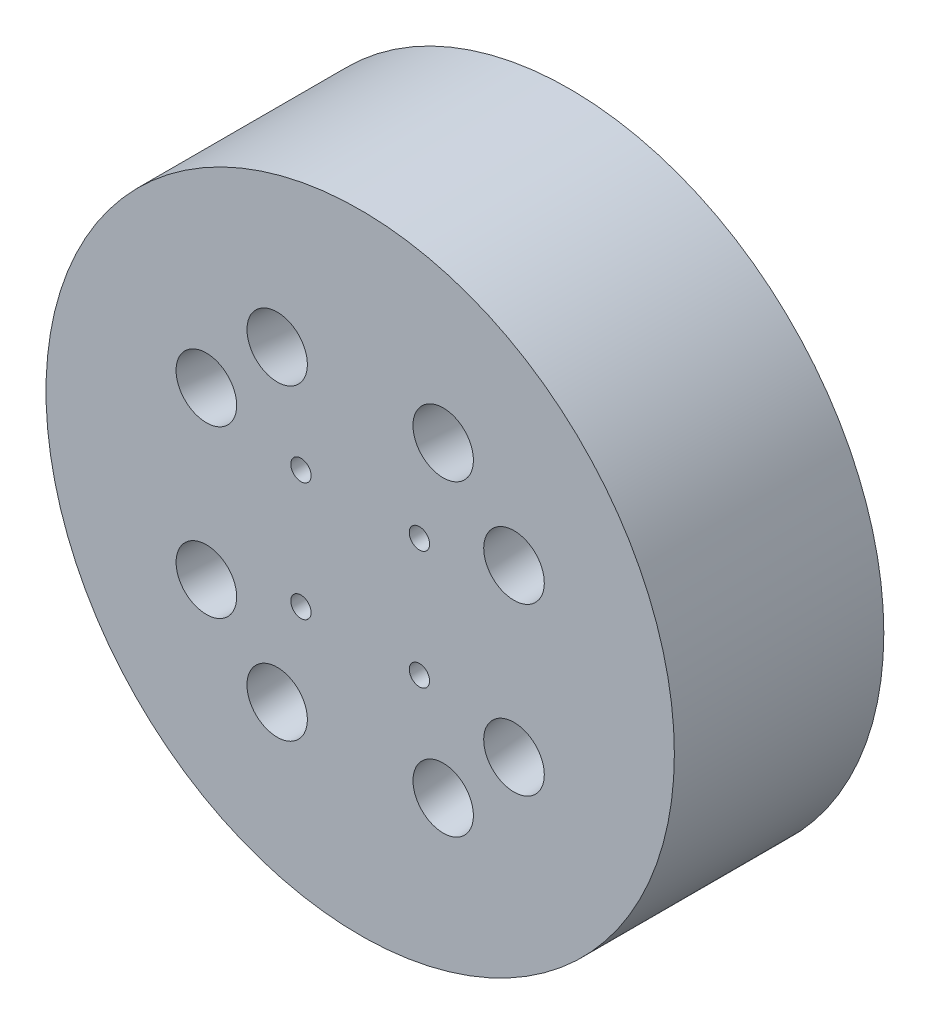
from build123d import *

# Parameters (mm, degrees)
SKETCH1_R                   = 15
BOSS_EXTRUDE1_DEPTH         = 10
SKETCH2_R                   = 0.484915
CUT_EXTRUDE1_DEPTH          = 10
CIRPATTERN1_COUNT           = 4
SKETCH7_R                   = 1.44135
CUT_EXTRUDE2_DEPTH          = 24.34691072
CIRPATTERN2_COUNT           = 4
CIRPATTERN2_COPY_1_SKETCH_R = 1.44135
CIRPATTERN2_COPY_1_DEPTH    = 24.34691072
CIRPATTERN2_COPY_2_SKETCH_R = 1.44135
CIRPATTERN2_COPY_2_DEPTH    = 24.34691072
CIRPATTERN2_COPY_3_SKETCH_R = 1.44135
CIRPATTERN2_COPY_3_DEPTH    = 24.34691072


with BuildPart() as part:
    # Sketch1 → Boss-Extrude1 (new body)
    with BuildSketch(Plane.XY):
        Circle(SKETCH1_R)
    extrude(amount=BOSS_EXTRUDE1_DEPTH)

    # Sketch2 → Cut-Extrude1 (cut)
    with BuildSketch(Plane.XY.offset(10)):
        with Locations((2.828427125, 2.828427125)):
            Circle(SKETCH2_R)
    cut_extrude1 = extrude(amount=-CUT_EXTRUDE1_DEPTH, mode=Mode.SUBTRACT)

    # CirPattern1: Cut-Extrude1 ×4 about axis
    cirpattern1_axis = Axis((0, 0, 10), (0, 0, -1))
    for i in range(1, CIRPATTERN1_COUNT):
        add(cut_extrude1.rotate(cirpattern1_axis, i * 360 / CIRPATTERN1_COUNT), mode=Mode.SUBTRACT)

    # Sketch7 → Cut-Extrude2 (cut, symmetric)
    with BuildSketch(Plane(origin=(-0.025287604, 0.006355569, 0.298027772), x_dir=(0.2437507452891652, 0.9698379112877453, 0), z_dir=(0.08452694350312104, -0.02124427725097248, -0.9961946980917455))):
        with Locations((2.053684635, -7.185898346)):
            Circle(SKETCH7_R)
    cut_extrude2 = extrude(amount=CUT_EXTRUDE2_DEPTH, both=True, mode=Mode.SUBTRACT)

    # Mirror1: Cut-Extrude2 across plane
    add(cut_extrude2.mirror(Plane(origin=(0, 0, 0), x_dir=(0, 0, 1), z_dir=(-0.7071067811865512, -0.7071067811865438, 0))), mode=Mode.SUBTRACT)

    # CirPattern2: Cut-Extrude2 ×4 about axis
    cirpattern2_axis = Axis((0, 0, 10), (0, 0, -1))
    for i in range(1, CIRPATTERN2_COUNT):
        add(cut_extrude2.rotate(cirpattern2_axis, i * 360 / CIRPATTERN2_COUNT), mode=Mode.SUBTRACT)

    # CirPattern2 copy 1 sketch → CirPattern2 copy 1 (cut, symmetric)
    with BuildSketch(Plane(origin=(0.025287604, 0.006355569, 0.298027772), x_dir=(-0.24375074528915505, 0.9698379112877479, 0), z_dir=(-0.08452694350312126, -0.021244277250971604, -0.9961946980917455))):
        with Locations((2.053684635, 7.185898346)):
            Circle(CIRPATTERN2_COPY_1_SKETCH_R)
    extrude(amount=CIRPATTERN2_COPY_1_DEPTH, both=True, mode=Mode.SUBTRACT)

    # CirPattern2 copy 2 sketch → CirPattern2 copy 2 (cut, symmetric)
    with BuildSketch(Plane(origin=(0.006355569, -0.025287604, 0.298027772), x_dir=(0.9698379112877479, 0.2437507452891551, 0), z_dir=(-0.02124427725097161, 0.08452694350312126, -0.9961946980917455))):
        with Locations((2.053684635, 7.185898346)):
            Circle(CIRPATTERN2_COPY_2_SKETCH_R)
    extrude(amount=CIRPATTERN2_COPY_2_DEPTH, both=True, mode=Mode.SUBTRACT)

    # CirPattern2 copy 3 sketch → CirPattern2 copy 3 (cut, symmetric)
    with BuildSketch(Plane(origin=(-0.025287604, -0.006355569, 0.298027772), x_dir=(0.24375074528915516, -0.9698379112877479, 0), z_dir=(0.08452694350312126, 0.021244277250971614, -0.9961946980917455))):
        with Locations((2.053684635, 7.185898346)):
            Circle(CIRPATTERN2_COPY_3_SKETCH_R)
    extrude(amount=CIRPATTERN2_COPY_3_DEPTH, both=True, mode=Mode.SUBTRACT)


solid = part.part
